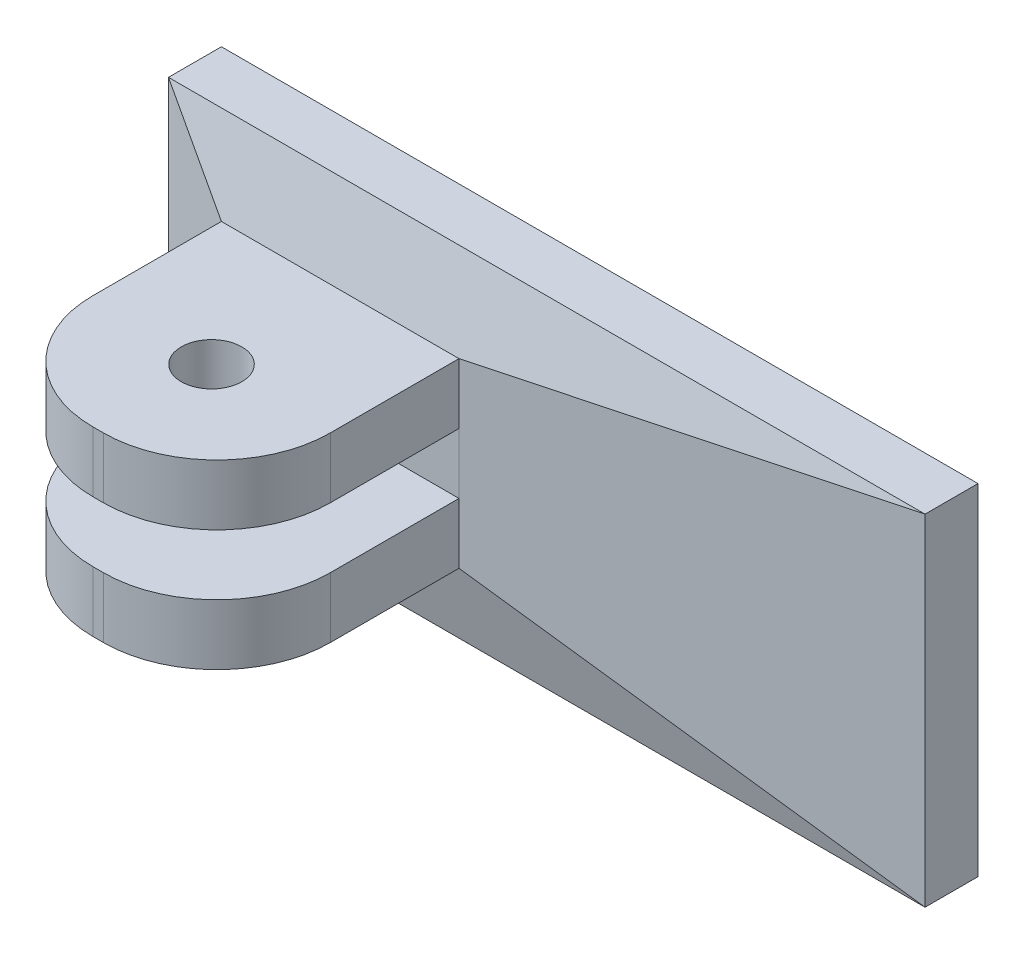
from build123d import *

# Parameters (mm, degrees)
SKETCH1_W           = 100
SKETCH1_H           = 45
BOSS_EXTRUDE1_DEPTH = 10
SKETCH3_W           = 31.4
SKETCH3_H           = 8
BOSS_EXTRUDE2_DEPTH = 5
SKETCH4_R           = 4
BOSS_EXTRUDE3_DEPTH = 8
CUT_EXTRUDE1_DEPTH  = 45
CUT_EXTRUDE2_DEPTH  = 100


with BuildPart() as part:
    # Sketch1 → Boss-Extrude1 (new body)
    with BuildSketch(Plane.XY):
        with Locations((26.050004349, -7.647768163)):
            Rectangle(SKETCH1_W, SKETCH1_H)
    extrude(amount=BOSS_EXTRUDE1_DEPTH)

    # Sketch3 → Boss-Extrude2 (add)
    with BuildSketch(Plane.XY.offset(10)):
        with Locations((1.750004349, 0.852231837)):
            Rectangle(SKETCH3_W, SKETCH3_H)
    boss_extrude2 = extrude(amount=BOSS_EXTRUDE2_DEPTH)

    # Sketch4 → Boss-Extrude3 (add)
    with BuildSketch(Plane.XZ.offset(3.147768163)):
        with BuildLine():
            Line((-13.949995651, 15), (-13.949995651, 27))
            ThreePointArc((-13.949995651, 27), (-9.556597369, 37.606601718), (1.050004349, 42))
            Line((1.050004349, 42), (2.450004349, 42))
            ThreePointArc((2.450004349, 42), (13.056606067, 37.606601718), (17.450004349, 27))
            Line((17.450004349, 27), (17.450004349, 15))
            Line((17.450004349, 15), (-13.949995651, 15))
        make_face()
        with Locations(Location((1.744890168, 27, 0), (0, 0, 270))):
            Circle(SKETCH4_R, mode=Mode.SUBTRACT)
    boss_extrude3 = extrude(amount=-BOSS_EXTRUDE3_DEPTH)

    # Mirror1: Boss-Extrude2, Boss-Extrude3 across plane
    add(boss_extrude2.mirror(Plane(origin=(0, -7.147768163, 0), x_dir=(0, 0, 1), z_dir=(0, -1, 0))))
    add(boss_extrude3.mirror(Plane(origin=(0, -7.147768163, 0), x_dir=(0, 0, 1), z_dir=(0, -1, 0))))

    # Sketch5 → Cut-Extrude1 (cut)
    with BuildSketch(Plane.XZ.offset(30.147768163)):
        Polygon((-13.949995651, 10), (-23.949995651, 7), (-23.949995651, 10), align=None)
        Polygon((17.450004349, 10), (76.050004349, 7), (76.050004349, 10), align=None)
    extrude(amount=-CUT_EXTRUDE1_DEPTH, mode=Mode.SUBTRACT)

    # Sketch6 → Cut-Extrude2 (cut)
    with BuildSketch(Plane.ZY.offset(23.949995651)):
        Polygon((7, 14.852231837), (10, 4.852231837), (10, 14.852231837), align=None)
        Polygon((10, -19.147768163), (7, -30.147768163), (10, -30.147768163), align=None)
    extrude(amount=-CUT_EXTRUDE2_DEPTH, mode=Mode.SUBTRACT)


solid = part.part
